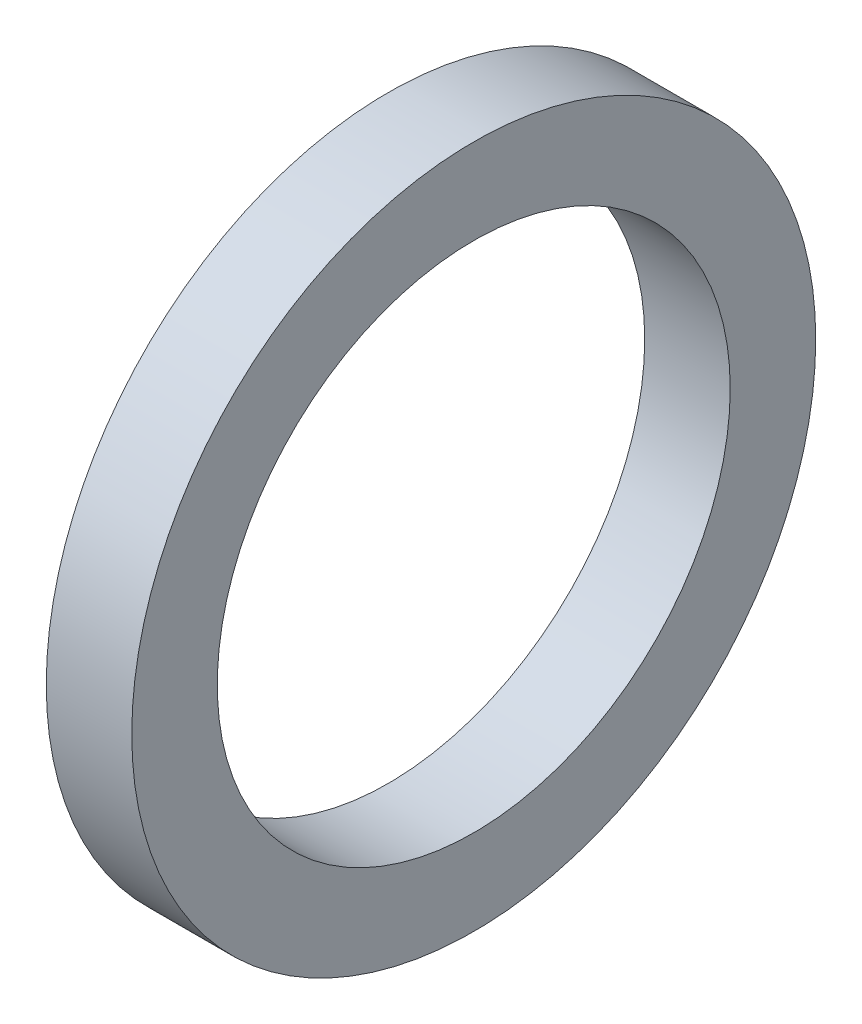
from build123d import *

# Parameters (mm, degrees)
SKETCH1_R           = 6.35
SKETCH1_R_2         = 4.7625
BOSS_EXTRUDE1_DEPTH = 1.5875


with BuildPart() as part:
    # Sketch1 → Boss-Extrude1 (new body)
    with BuildSketch(Plane(origin=(0, 0, 0), x_dir=(0, 0, -1), z_dir=(1, 0, 0))):
        Circle(SKETCH1_R)
        Circle(SKETCH1_R_2, mode=Mode.SUBTRACT)
    extrude(amount=BOSS_EXTRUDE1_DEPTH)


solid = part.part
